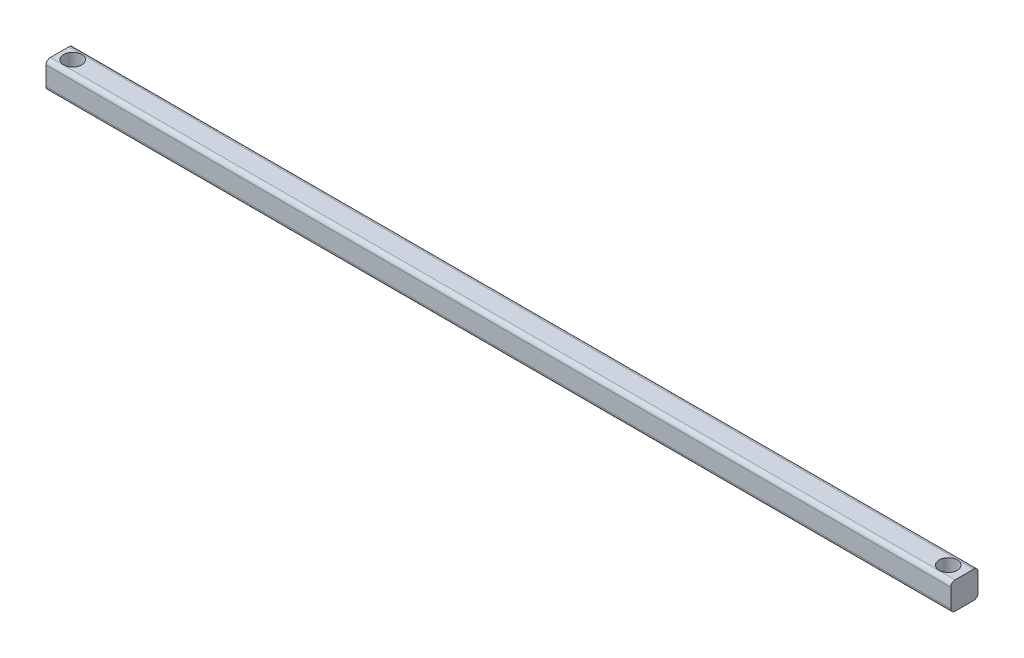
from build123d import *

# Parameters (mm, degrees)
SKETCH_1_W          = 6.32
SKETCH_1_H          = 6.32
EXTRUDE_1_DEPTH     = 210
SKETCH_2_R          = 2.1
CUT_EXTRUDE_1_DEPTH = 210
FILLET_1_R          = 1


with BuildPart() as part:
    # 草图1 → 凸台-拉伸1 (new body)
    with BuildSketch(Plane(origin=(0, 0, 0), x_dir=(0, 0, -1), z_dir=(1, 0, 0))):
        Rectangle(SKETCH_1_W, SKETCH_1_H)
    extrude(amount=EXTRUDE_1_DEPTH)

    # 草图2 → 切除-拉伸1 (cut)
    with BuildSketch(Plane(origin=(0, 3.16, 0), x_dir=(1, 0, 0), z_dir=(0, 1, 0))):
        with Locations(Location((3.043341723, 0, 0), (0, 0, 270))):
            Circle(SKETCH_2_R)
        with Locations(Location((206.243341723, 0, 0), (0, 0, 270))):
            Circle(SKETCH_2_R)
    extrude(amount=-CUT_EXTRUDE_1_DEPTH, mode=Mode.SUBTRACT)

    # 圆角1
    fillet_1_edges = [part.edges().sort_by_distance(p)[0] for p in [
        (105, -3.16, -3.16),
        (105, -3.16, 3.16),
        (105, 3.16, 3.16),
        (105, 3.16, -3.16),
    ]]
    fillet(fillet_1_edges, radius=FILLET_1_R)


solid = part.part
